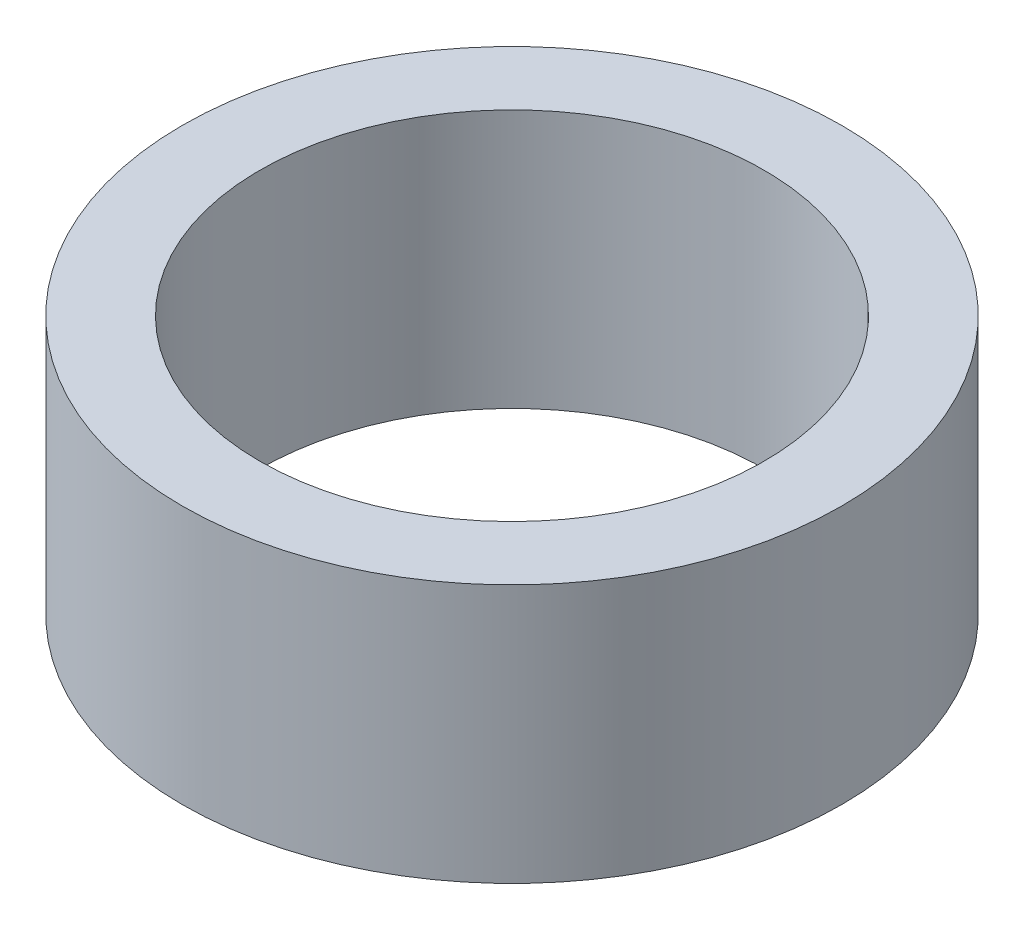
from build123d import *

# Parameters (mm, degrees)
SKETCH1_R           = 12.75
SKETCH1_R_2         = 9.75
BOSS_EXTRUDE1_DEPTH = 10


with BuildPart() as part:
    # Sketch1 → Boss-Extrude1 (new body)
    with BuildSketch(Plane(origin=(0, 0, 0), x_dir=(1, 0, 0), z_dir=(0, 1, 0))):
        with Locations(Location((0, 0, 0), (0, 0, 270))):
            Circle(SKETCH1_R)
        with Locations(Location((0, 0, 0), (0, 0, 270))):
            Circle(SKETCH1_R_2, mode=Mode.SUBTRACT)
    extrude(amount=BOSS_EXTRUDE1_DEPTH)


solid = part.part
